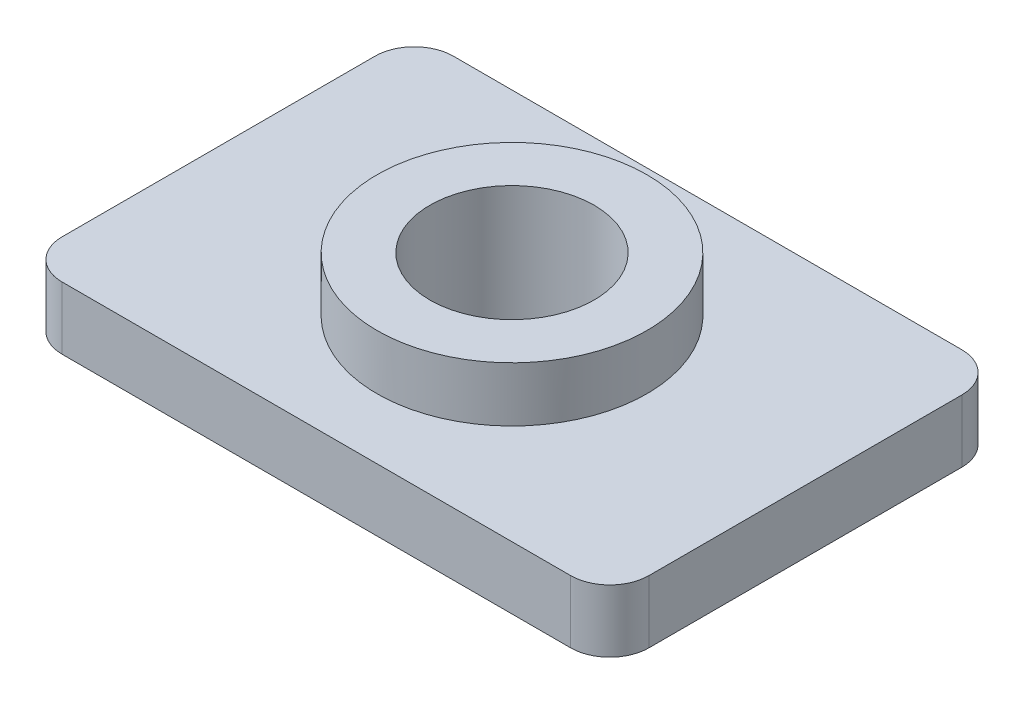
from build123d import *

# Parameters (mm, degrees)
SALIENTE_EXTRUIR1_DEPTH = 1.6
CROQUIS2_R              = 3.45
SALIENTE_EXTRUIR2_DEPTH = 1.4
CORTAR_EXTRUIR1_REACH   = 20.276
CROQUIS3_R              = 2.1


with BuildPart() as part:
    # Croquis1 → Saliente-Extruir1 (new body)
    with BuildSketch(Plane(origin=(0, 0, 0), x_dir=(1, 0, 0), z_dir=(0, 1, 0))):
        with BuildLine():
            Line((1, 0), (14, 0))
            ThreePointArc((14, 0), (14.707106781, 0.292893219), (15, 1))
            Line((15, 1), (15, 9))
            ThreePointArc((15, 9), (14.707106781, 9.707106781), (14, 10))
            Line((14, 10), (1, 10))
            ThreePointArc((1, 10), (0.292893219, 9.707106781), (0, 9))
            Line((0, 9), (0, 1))
            ThreePointArc((0, 1), (0.292893219, 0.292893219), (1, 0))
        make_face()
    extrude(amount=SALIENTE_EXTRUIR1_DEPTH)

    # Croquis2 → Saliente-Extruir2 (add)
    with BuildSketch(Plane(origin=(0, 1.6, 0), x_dir=(1, 0, 0), z_dir=(0, 1, 0))):
        with Locations(Location((7.5, 5, 0), (0, 0, 90))):
            Circle(CROQUIS2_R)
    extrude(amount=SALIENTE_EXTRUIR2_DEPTH)

    # Croquis3 → Cortar-Extruir1 (cut, up to next)
    with BuildSketch(Plane(origin=(0, 3, 0), x_dir=(1, 0, 0), z_dir=(0, 1, 0)), mode=Mode.PRIVATE) as cortar_extruir1_sk1:
        with Locations(Location((7.5, 5, 0), (0, 0, 270))):
            Circle(CROQUIS3_R)
    cortar_extruir1_tool1 = extrude(cortar_extruir1_sk1.sketch, amount=-CORTAR_EXTRUIR1_REACH, mode=Mode.PRIVATE) & part.part
    add(cortar_extruir1_tool1.solids().sort_by_distance((7.5, 3, -5))[0], mode=Mode.SUBTRACT)


solid = part.part
